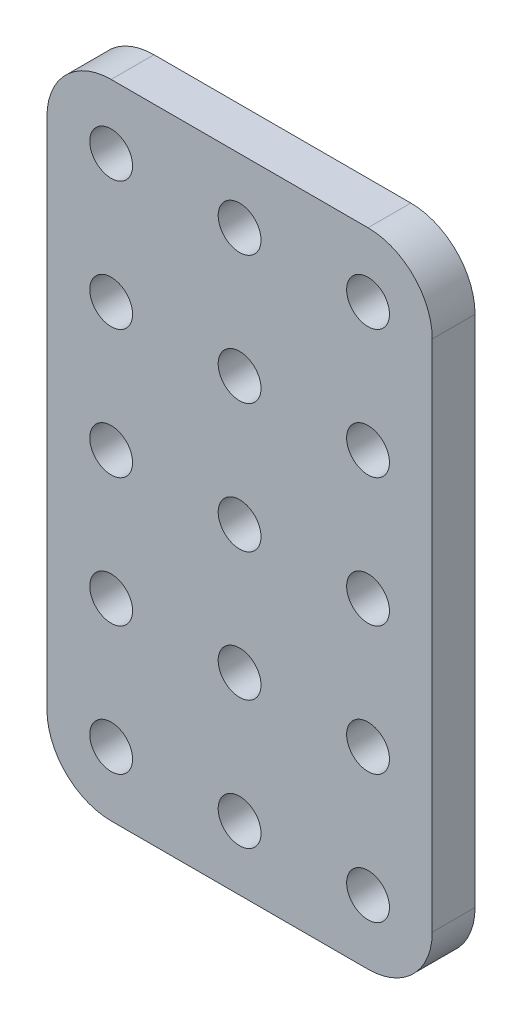
from build123d import *

# Parameters (mm, degrees)
MODEL_R                 = 1.5
SALIENTE_EXTRUIR1_DEPTH = 3


with BuildPart() as part:
    # Model → Saliente-Extruir1 (new body)
    with BuildSketch(Plane.XY):
        with BuildLine():
            Line((-105.943383637, 101.056539338), (-105.943383637, 65.056539338))
            ThreePointArc((-105.943383637, 65.056539338), (-104.625364152, 61.874558823), (-101.443383637, 60.556539338))
            Line((-101.443383637, 60.556539338), (-83.443383637, 60.556539338))
            ThreePointArc((-83.443383637, 60.556539338), (-80.261403122, 61.874558823), (-78.943383637, 65.056539338))
            Line((-78.943383637, 65.056539338), (-78.943383637, 101.056539338))
            ThreePointArc((-78.943383637, 101.056539338), (-80.261403122, 104.238519853), (-83.443383637, 105.556539338))
            Line((-83.443383637, 105.556539338), (-101.443383637, 105.556539338))
            ThreePointArc((-101.443383637, 105.556539338), (-104.625364152, 104.238519853), (-105.943383637, 101.056539338))
        make_face()
        with Locations((-101.443383637, 101.056539338)):
            Circle(MODEL_R, mode=Mode.SUBTRACT)
        with Locations((-92.443383637, 101.056539338)):
            Circle(MODEL_R, mode=Mode.SUBTRACT)
        with Locations((-83.443383637, 101.056539338)):
            Circle(MODEL_R, mode=Mode.SUBTRACT)
        with Locations((-101.443383637, 92.056539338)):
            Circle(MODEL_R, mode=Mode.SUBTRACT)
        with Locations((-92.443383637, 92.056539338)):
            Circle(MODEL_R, mode=Mode.SUBTRACT)
        with Locations((-83.443383637, 92.056539338)):
            Circle(MODEL_R, mode=Mode.SUBTRACT)
        with Locations((-101.443383637, 83.056539338)):
            Circle(MODEL_R, mode=Mode.SUBTRACT)
        with Locations((-92.443383637, 83.056539338)):
            Circle(MODEL_R, mode=Mode.SUBTRACT)
        with Locations((-83.443383637, 83.056539338)):
            Circle(MODEL_R, mode=Mode.SUBTRACT)
        with Locations((-101.443383637, 74.056539338)):
            Circle(MODEL_R, mode=Mode.SUBTRACT)
        with Locations((-92.443383637, 74.056539338)):
            Circle(MODEL_R, mode=Mode.SUBTRACT)
        with Locations((-83.443383637, 74.056539338)):
            Circle(MODEL_R, mode=Mode.SUBTRACT)
        with Locations((-101.443383637, 65.056539338)):
            Circle(MODEL_R, mode=Mode.SUBTRACT)
        with Locations((-92.443383637, 65.056539338)):
            Circle(MODEL_R, mode=Mode.SUBTRACT)
        with Locations((-83.443383637, 65.056539338)):
            Circle(MODEL_R, mode=Mode.SUBTRACT)
    extrude(amount=SALIENTE_EXTRUIR1_DEPTH)


solid = part.part
